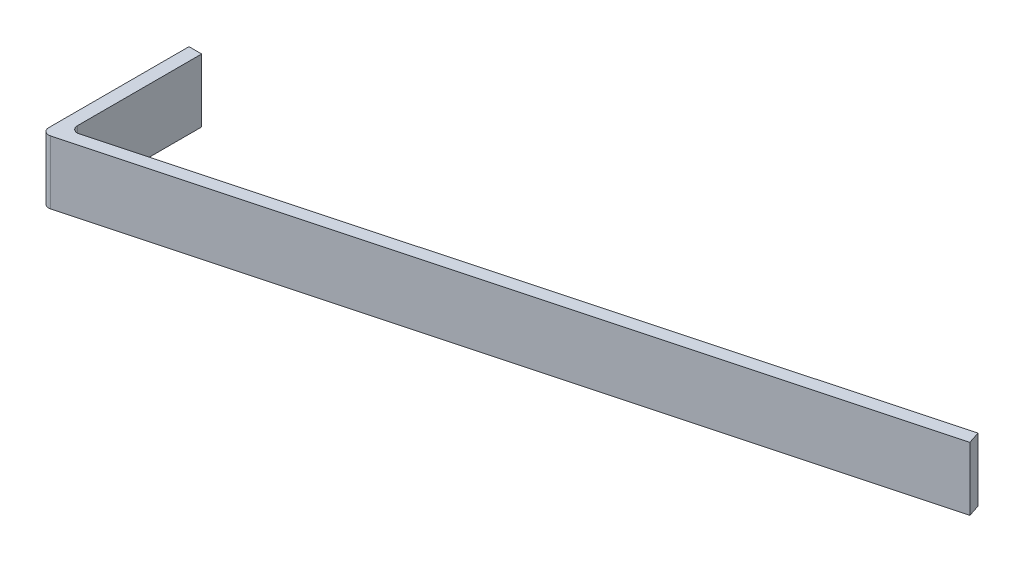
from build123d import *

# Parameters (mm, degrees)
BOSS_EXTRUDE1_DEPTH = 10
BOSS_EXTRUDE2_DEPTH = 10
FILLET1_R           = 1


with BuildPart() as part:
    # Sketch1 → Boss-Extrude1 (new body)
    with BuildSketch(Plane(origin=(0, 0, 0), x_dir=(1, 0, 0), z_dir=(0, 1, 0))):
        Polygon((0, 0), (2, 0.535898385), (2, 23.5), (0, 23.5), align=None)
    extrude(amount=BOSS_EXTRUDE1_DEPTH)

    # Sketch3 → Boss-Extrude2 (add)
    with BuildSketch(Plane.XZ):
        Polygon((0, 0), (115.911099155, -31.058285412), (115.285791267, -32.958019616), (0, -2), align=None)
    extrude(amount=-BOSS_EXTRUDE2_DEPTH)

    # Fillet1
    fillet1_edges = [part.edges().sort_by_distance(p)[0] for p in [
        (2, 5, -2.537065657),
        (0, 5, 0),
    ]]
    fillet(fillet1_edges, radius=FILLET1_R)


solid = part.part
